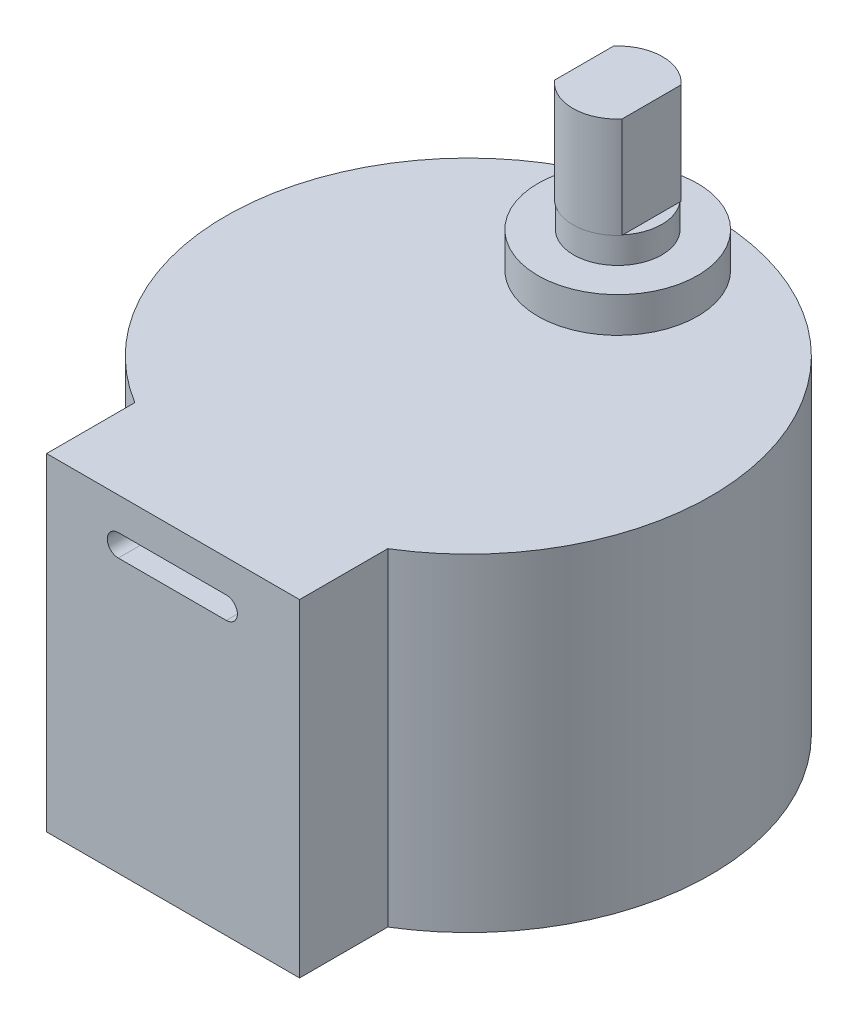
from build123d import *

# Parameters (mm, degrees)
BOSS_EXTRUDE1_DEPTH = 18.8722
SKETCH3_R           = 4.5974
SKETCH3_R_2         = 2.54
BOSS_EXTRUDE2_DEPTH = 2.032
SKETCH3_2_R         = 4.5974
SKETCH3_2_R_2       = 2.54
BOSS_EXTRUDE3_DEPTH = 2.032
SKETCH4_R           = 2.54
BOSS_EXTRUDE4_DEPTH = 3.556
BOSS_EXTRUDE5_DEPTH = 5.8039
CUT_EXTRUDE1_DEPTH  = 7.62


with BuildPart() as part:
    # Sketch1 → Boss-Extrude1 (new body)
    with BuildSketch(Plane(origin=(0, 0, 0), x_dir=(1, 0, 0), z_dir=(0, 1, 0))):
        with BuildLine():
            Line((-7.28345, -11.921084519), (-7.28345, -17.001084519))
            Line((-7.28345, -17.001084519), (7.28345, -17.001084519))
            Line((7.28345, -17.001084519), (7.28345, -11.921084519))
            ThreePointArc((7.28345, -11.921084519), (0, 13.97), (-7.28345, -11.921084519))
        make_face()
    extrude(amount=BOSS_EXTRUDE1_DEPTH)

    # Sketch3 → Boss-Extrude2 (add)
    with BuildSketch(Plane(origin=(0, 18.8722, 0), x_dir=(1, 0, 0), z_dir=(0, 1, 0))):
        with Locations((0.01905, 8.585233697)):
            Circle(SKETCH3_R)
        with Locations((0.01905, 8.585233697)):
            Circle(SKETCH3_R_2, mode=Mode.SUBTRACT)
    extrude(amount=BOSS_EXTRUDE2_DEPTH)

    # Sketch3<2> → Boss-Extrude3 (add)
    with BuildSketch(Plane(origin=(0, 18.8722, 0), x_dir=(1, 0, 0), z_dir=(0, 1, 0))):
        with Locations((0.01905, 8.585233697)):
            Circle(SKETCH3_2_R)
        with Locations((0.01905, 8.585233697)):
            Circle(SKETCH3_2_R_2, mode=Mode.SUBTRACT)
    extrude(amount=BOSS_EXTRUDE3_DEPTH)

    # Sketch4 → Boss-Extrude4 (add)
    with BuildSketch(Plane(origin=(0, 18.8722, 0), x_dir=(1, 0, 0), z_dir=(0, 1, 0))):
        with Locations((0.01905, 8.585233697)):
            Circle(SKETCH4_R)
    extrude(amount=BOSS_EXTRUDE4_DEPTH)

    # Sketch5 → Boss-Extrude5 (add)
    with BuildSketch(Plane(origin=(0, 22.4282, 0), x_dir=(1, 0, 0), z_dir=(0, 1, 0))):
        with BuildLine():
            Line((-1.921484266, 10.287033697), (-1.921484266, 6.883433697))
            ThreePointArc((-1.921484266, 6.883433697), (0.01905, 6.00418808), (1.959584266, 6.883433697))
            Line((1.959584266, 6.883433697), (1.959584266, 10.287033697))
            ThreePointArc((1.959584266, 10.287033697), (0.01905, 11.166279314), (-1.921484266, 10.287033697))
        make_face()
    extrude(amount=BOSS_EXTRUDE5_DEPTH)

    # Sketch6 → Cut-Extrude1 (cut)
    with BuildSketch(Plane.XY.offset(17.001084519)):
        with BuildLine():
            Line((-3.15595, 16.994300905), (3.06705, 16.994300905))
            ThreePointArc((3.06705, 16.994300905), (3.70205, 16.359300905), (3.06705, 15.724300905))
            Line((3.06705, 15.724300905), (-3.15595, 15.724300905))
            ThreePointArc((-3.15595, 15.724300905), (-3.79095, 16.359300905), (-3.15595, 16.994300905))
        make_face()
    extrude(amount=-CUT_EXTRUDE1_DEPTH, mode=Mode.SUBTRACT)


solid = part.part
